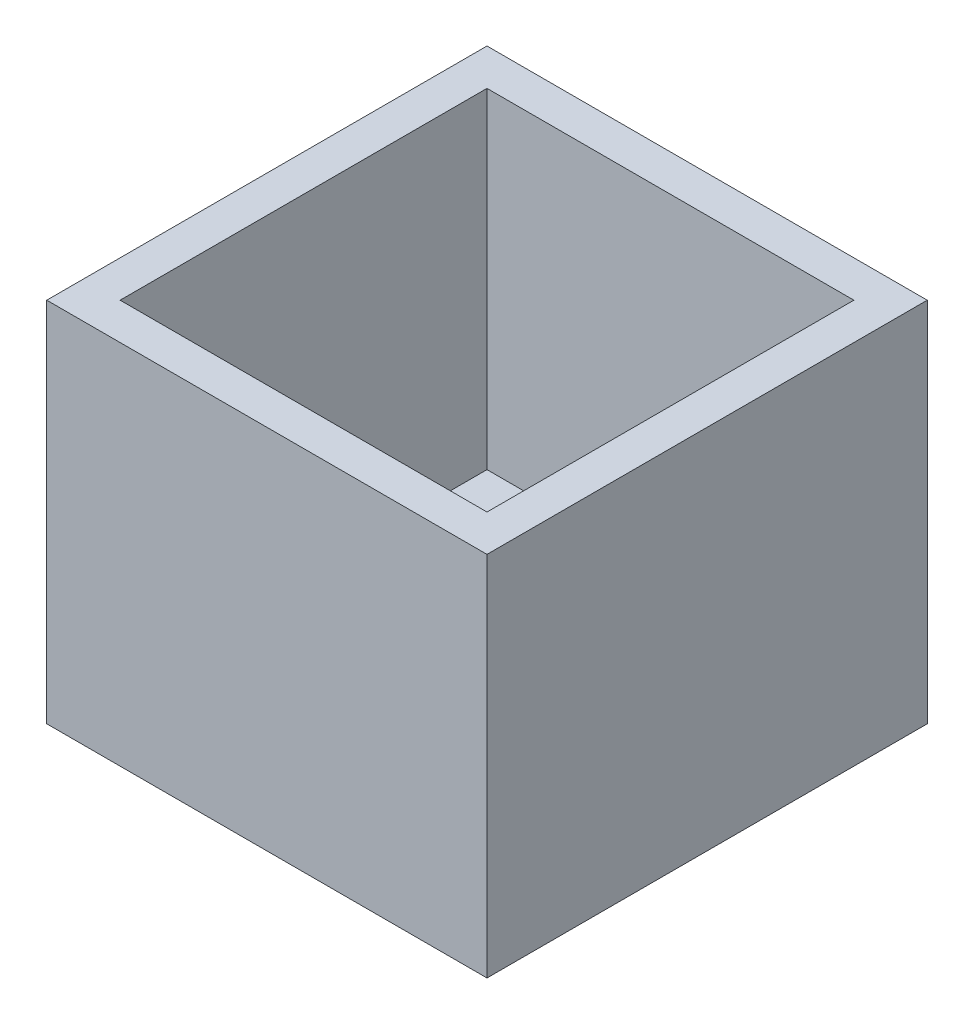
from build123d import *

# Parameters (mm, degrees)
SKETCH_1_W          = 120
SKETCH_1_H          = 120
EXTRUDE_1_DEPTH     = 100
SKETCH_2_W          = 100
SKETCH_2_H          = 100
CUT_EXTRUDE_1_DEPTH = 90


with BuildPart() as part:
    # 草图1 → 凸台-拉伸1 (new body)
    with BuildSketch(Plane(origin=(0, 0, 0), x_dir=(1, 0, 0), z_dir=(0, 1, 0))):
        Rectangle(SKETCH_1_W, SKETCH_1_H)
    extrude(amount=EXTRUDE_1_DEPTH)

    # 草图2 → 切除-拉伸1 (cut)
    with BuildSketch(Plane(origin=(0, 100, 0), x_dir=(1, 0, 0), z_dir=(0, 1, 0))):
        Rectangle(SKETCH_2_W, SKETCH_2_H)
    extrude(amount=-CUT_EXTRUDE_1_DEPTH, mode=Mode.SUBTRACT)


solid = part.part
